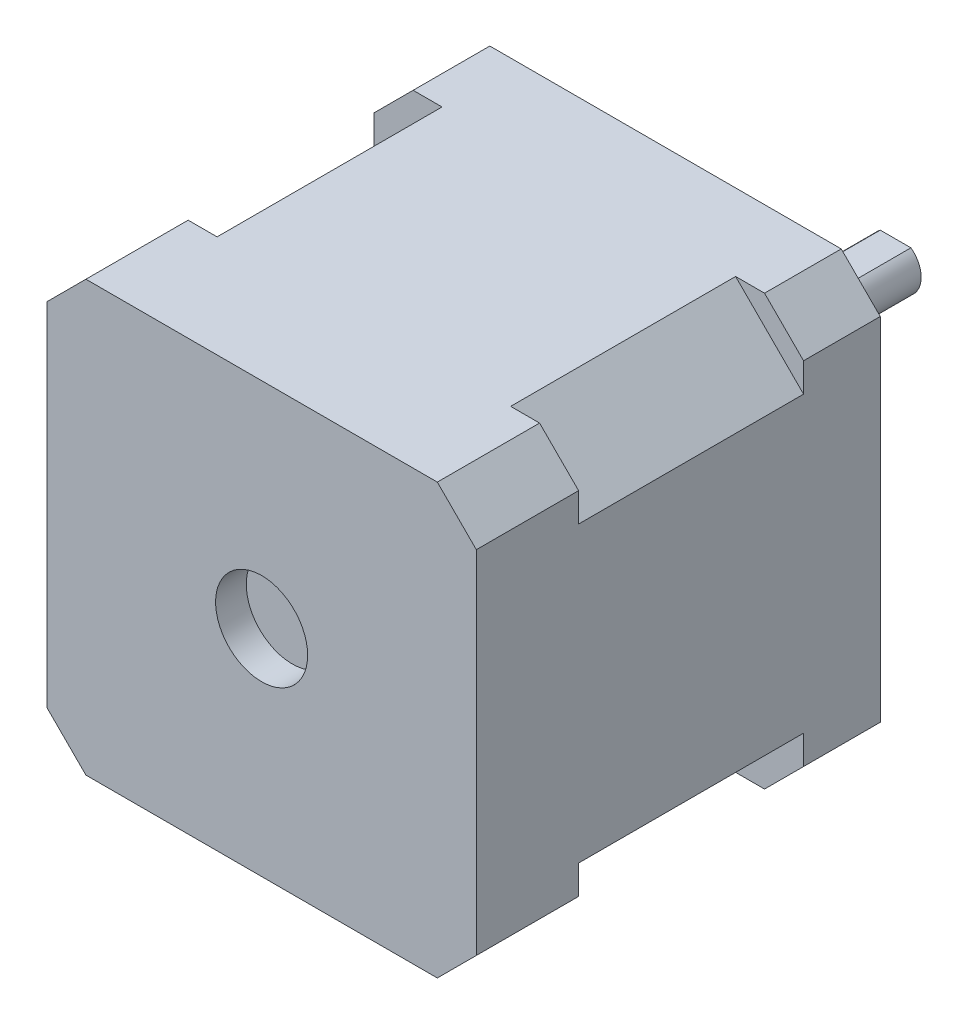
from build123d import *

# Parameters (mm, degrees)
EXTRUDE_1_DEPTH     = 39.5
SKETCH_2_R          = 11
EXTRUDE_2_DEPTH     = 2
SKETCH_3_R          = 2.5
EXTRUDE_3_DEPTH     = 20.5
SKETCH_4_R          = 1.5
CUT_EXTRUDE_1_DEPTH = 5
CUT_EXTRUDE_START   = -18
CUT_EXTRUDE_2_DEPTH = 18
SKETCH_6_R          = 4.5
CUT_EXTRUDE_3_DEPTH = 3
CUT_EXTRUDE_START_2 = -3
SKETCH_7_R          = 4.5
SKETCH_7_R_2        = 2.5
CUT_EXTRUDE_4_DEPTH = 3
SKETCH_8_W          = 61.801157568
SKETCH_8_H          = 60.217907666
CUT_EXTRUDE_5_DEPTH = 22


with BuildPart() as part:
    # 草图1 → 凸台-拉伸1 (new body)
    with BuildSketch(Plane.XY):
        Polygon((-17.183766184, 21), (17.183766184, 21), (21, 17.183766184), (21, -17.183766184), (17.183766184, -21), (-17.183766184, -21), (-21, -17.183766184), (-21, 17.183766184), align=None)
    extrude(amount=EXTRUDE_1_DEPTH)

    # 草图2 → 凸台-拉伸2 (add)
    with BuildSketch(Plane(origin=(0, 0, 0), x_dir=(-1, 0, 0), z_dir=(0, 0, -1))):
        Circle(SKETCH_2_R)
    extrude(amount=EXTRUDE_2_DEPTH)

    # 草图3 → 凸台-拉伸3 (add)
    with BuildSketch(Plane(origin=(0, 0, -2), x_dir=(-1, 0, 0), z_dir=(0, 0, -1))):
        Circle(SKETCH_3_R)
    extrude(amount=EXTRUDE_3_DEPTH)

    # 草图4 → 切除-拉伸1 (cut)
    with BuildSketch(Plane(origin=(0, 0, 0), x_dir=(-1, 0, 0), z_dir=(0, 0, -1))):
        with Locations((-15.5, -15.5)):
            Circle(SKETCH_4_R)
        with Locations((-15.5, 15.5)):
            Circle(SKETCH_4_R)
        with Locations((15.5, 15.5)):
            Circle(SKETCH_4_R)
        with Locations((15.5, -15.5)):
            Circle(SKETCH_4_R)
    extrude(amount=-CUT_EXTRUDE_1_DEPTH, mode=Mode.SUBTRACT)

    # 草图5 → 切除-拉伸2 (cut)
    with BuildSketch(Plane(origin=(0, 0, -22.5), x_dir=(-1, 0, 0), z_dir=(0, 0, -1)).offset(CUT_EXTRUDE_START)):
        with BuildLine():
            Line((1.5, 2), (-1.5, 2))
            ThreePointArc((-1.5, 2), (0, 2.5), (1.5, 2))
        make_face()
    extrude(amount=CUT_EXTRUDE_2_DEPTH, mode=Mode.SUBTRACT)

    # 草图6 → 切除-拉伸3 (cut)
    with BuildSketch(Plane.XY.offset(39.5)):
        Circle(SKETCH_6_R)
    extrude(amount=-CUT_EXTRUDE_3_DEPTH, mode=Mode.SUBTRACT)

    # 草图7 → 切除-拉伸4 (cut)
    with BuildSketch(Plane(origin=(0, 0, -2), x_dir=(-1, 0, 0), z_dir=(0, 0, -1)).offset(CUT_EXTRUDE_START_2)):
        with Locations(Location((0, 0, 0), (0, 0, 180))):
            Circle(SKETCH_7_R)
        with Locations(Location((0, 0, 0), (0, 0, 126.869897646))):
            Circle(SKETCH_7_R_2, mode=Mode.SUBTRACT)
    extrude(amount=CUT_EXTRUDE_4_DEPTH, mode=Mode.SUBTRACT)

    # 草图8 → 切除-拉伸5 (cut)
    with BuildSketch(Plane.XY.offset(29.5)):
        Rectangle(SKETCH_8_W, SKETCH_8_H)
        Polygon((21, -14.355339059), (21, 14.355339059), (14.355339059, 21), (-14.355339059, 21), (-21, 14.355339059), (-21, -14.355339059), (-14.355339059, -21), (14.355339059, -21), align=None, mode=Mode.SUBTRACT)
    extrude(amount=-CUT_EXTRUDE_5_DEPTH, mode=Mode.SUBTRACT)


solid = part.part
